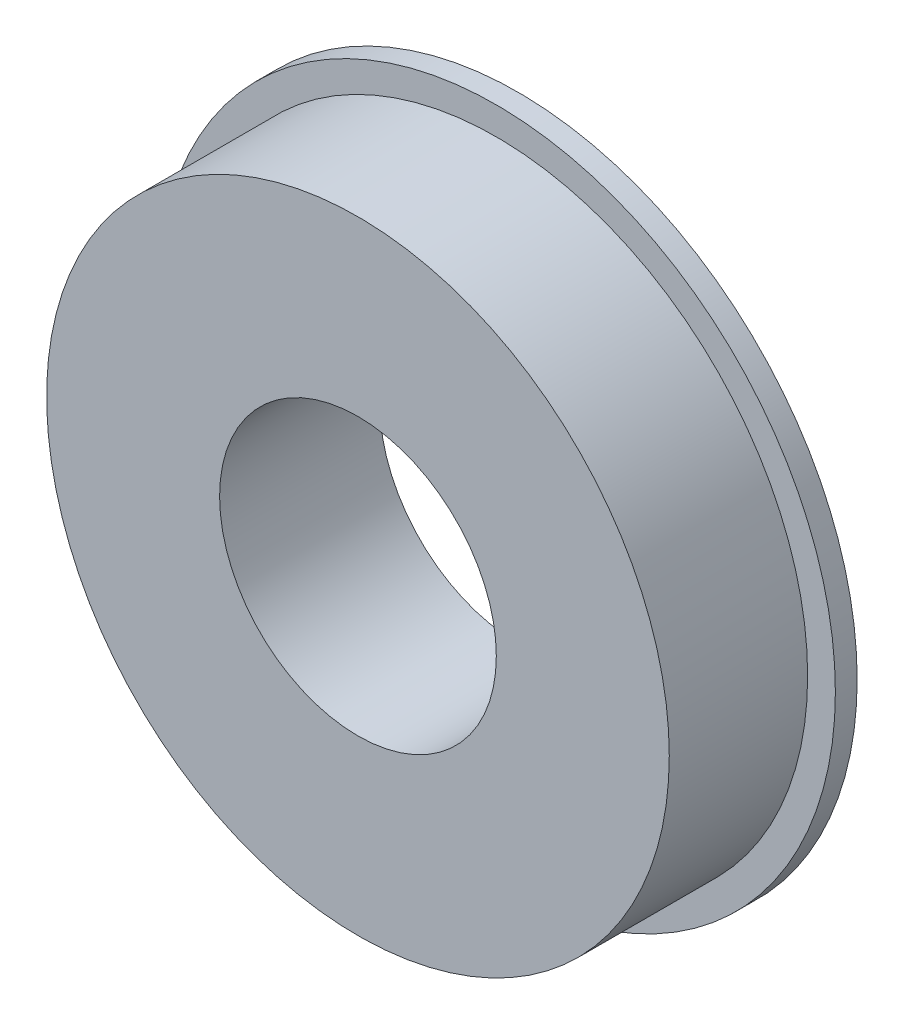
from build123d import *

# Parameters (mm, degrees)
SKETCH1_R           = 14.2875
SKETCH1_R_2         = 6.35
BOSS_EXTRUDE1_DEPTH = 7.35
SKETCH1_3_R         = 15.56004
SKETCH1_3_R_2       = 14.2875
BOSS_EXTRUDE2_DEPTH = 1


with BuildPart() as part:
    # Sketch1 → Boss-Extrude1 (new body)
    with BuildSketch(Plane.XY):
        Circle(SKETCH1_R)
        Circle(SKETCH1_R_2, mode=Mode.SUBTRACT)
    extrude(amount=BOSS_EXTRUDE1_DEPTH)

    # Sketch1<3> → Boss-Extrude2 (add)
    with BuildSketch(Plane.XY):
        Circle(SKETCH1_3_R)
        Circle(SKETCH1_3_R_2, mode=Mode.SUBTRACT)
    extrude(amount=BOSS_EXTRUDE2_DEPTH)


solid = part.part
